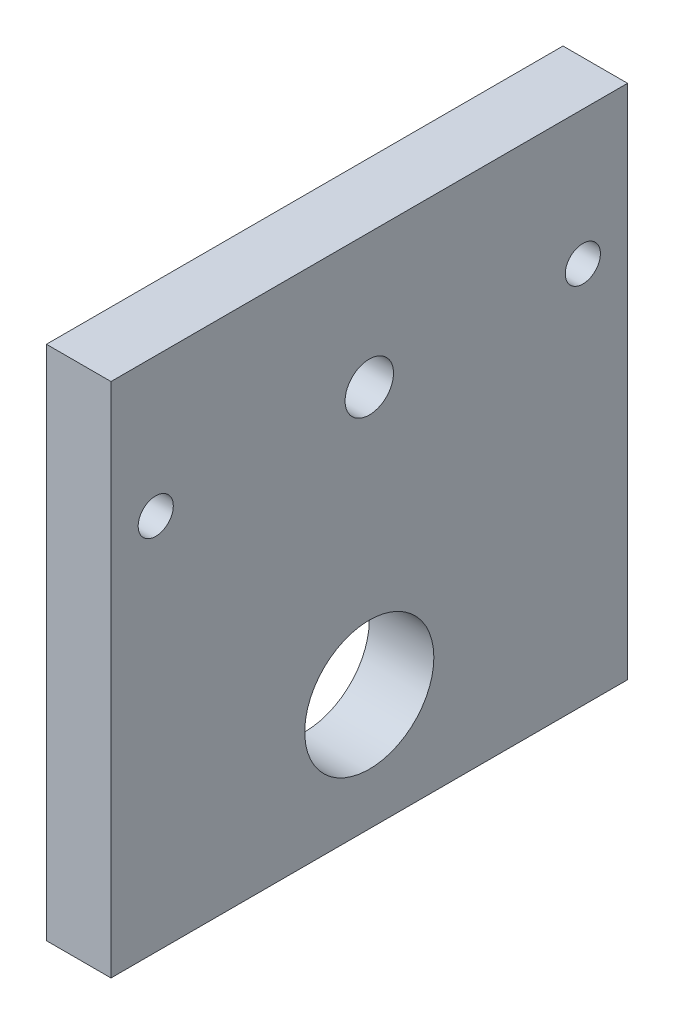
from build123d import *

# Parameters (mm, degrees)
SKETCH1_W                          = 50.8
SKETCH1_H                          = 50.8
BOSS_EXTRUDE1_DEPTH                = 6.35
F_1_2_0_5_DIAMETER_HOLE1_D         = 12.7
F_1_2_0_5_DIAMETER_HOLE1_DEPTH     = 70.104
F_1_2_0_5_DIAMETER_HOLE1_TIP       = 3.815464931
F_3_16_0_1875_DIAMETER_HOLE1_D     = 4.7625
F_3_16_0_1875_DIAMETER_HOLE1_DEPTH = 70.104
F_3_16_0_1875_DIAMETER_HOLE1_TIP   = 1.430799349
F_29_0_136_DIAMETER_HOLE1_D        = 3.4544
F_29_0_136_DIAMETER_HOLE1_DEPTH    = 70.104
F_29_0_136_DIAMETER_HOLE1_TIP      = 1.037806461
F_10_32_TAPPED_HOLE1_D             = 4.0386
F_10_32_TAPPED_HOLE1_DEPTH         = 11.938
F_10_32_TAPPED_HOLE1_TIP           = 1.213317848


with BuildPart() as part:
    # Sketch1 → Boss-Extrude1 (new body)
    with BuildSketch(Plane(origin=(0, 0, 0), x_dir=(0, 0, -1), z_dir=(1, 0, 0))):
        Rectangle(SKETCH1_W, SKETCH1_H)
    extrude(amount=BOSS_EXTRUDE1_DEPTH)

    # 1/2 (0.5) Diameter Hole1
    with Locations(Plane(origin=(6.35, 0, 0), x_dir=(0, 0, -1), z_dir=(1, 0, 0))):
        with Locations((0, -13.97)):
            Hole(F_1_2_0_5_DIAMETER_HOLE1_D / 2, depth=F_1_2_0_5_DIAMETER_HOLE1_DEPTH)
            with Locations((0, 0, -(F_1_2_0_5_DIAMETER_HOLE1_DEPTH + F_1_2_0_5_DIAMETER_HOLE1_TIP / 2))):  # 118° drill point
                Cone(0, F_1_2_0_5_DIAMETER_HOLE1_D / 2, F_1_2_0_5_DIAMETER_HOLE1_TIP, mode=Mode.SUBTRACT)

    # 3/16 (0.1875) Diameter Hole1
    with Locations(Plane(origin=(6.35, 0, 0), x_dir=(0, 0, -1), z_dir=(1, 0, 0))):
        with Locations((0, 12.2301)):
            Hole(F_3_16_0_1875_DIAMETER_HOLE1_D / 2, depth=F_3_16_0_1875_DIAMETER_HOLE1_DEPTH)
            with Locations((0, 0, -(F_3_16_0_1875_DIAMETER_HOLE1_DEPTH + F_3_16_0_1875_DIAMETER_HOLE1_TIP / 2))):  # 118° drill point
                Cone(0, F_3_16_0_1875_DIAMETER_HOLE1_D / 2, F_3_16_0_1875_DIAMETER_HOLE1_TIP, mode=Mode.SUBTRACT)

    # #29 (0.136) Diameter Hole1
    with Locations(Plane(origin=(6.35, 0, 0), x_dir=(0, 0, -1), z_dir=(1, 0, 0))):
        with Locations((21, 12.2301), (-21, 11.74145915)):
            Hole(F_29_0_136_DIAMETER_HOLE1_D / 2, depth=F_29_0_136_DIAMETER_HOLE1_DEPTH)
            with Locations((0, 0, -(F_29_0_136_DIAMETER_HOLE1_DEPTH + F_29_0_136_DIAMETER_HOLE1_TIP / 2))):  # 118° drill point
                Cone(0, F_29_0_136_DIAMETER_HOLE1_D / 2, F_29_0_136_DIAMETER_HOLE1_TIP, mode=Mode.SUBTRACT)

    # #10-32 Tapped Hole1
    with Locations(Plane(origin=(-0.669296778, 7.980106856, -25.4), x_dir=(-1, 0, 0), z_dir=(0, 0, -1))):
        with Locations((-3.844296778, -27.030106856), (-3.844296778, 11.069893144)):
            Hole(F_10_32_TAPPED_HOLE1_D / 2, depth=F_10_32_TAPPED_HOLE1_DEPTH)
            with Locations((0, 0, -(F_10_32_TAPPED_HOLE1_DEPTH + F_10_32_TAPPED_HOLE1_TIP / 2))):  # 118° drill point
                Cone(0, F_10_32_TAPPED_HOLE1_D / 2, F_10_32_TAPPED_HOLE1_TIP, mode=Mode.SUBTRACT)


solid = part.part
